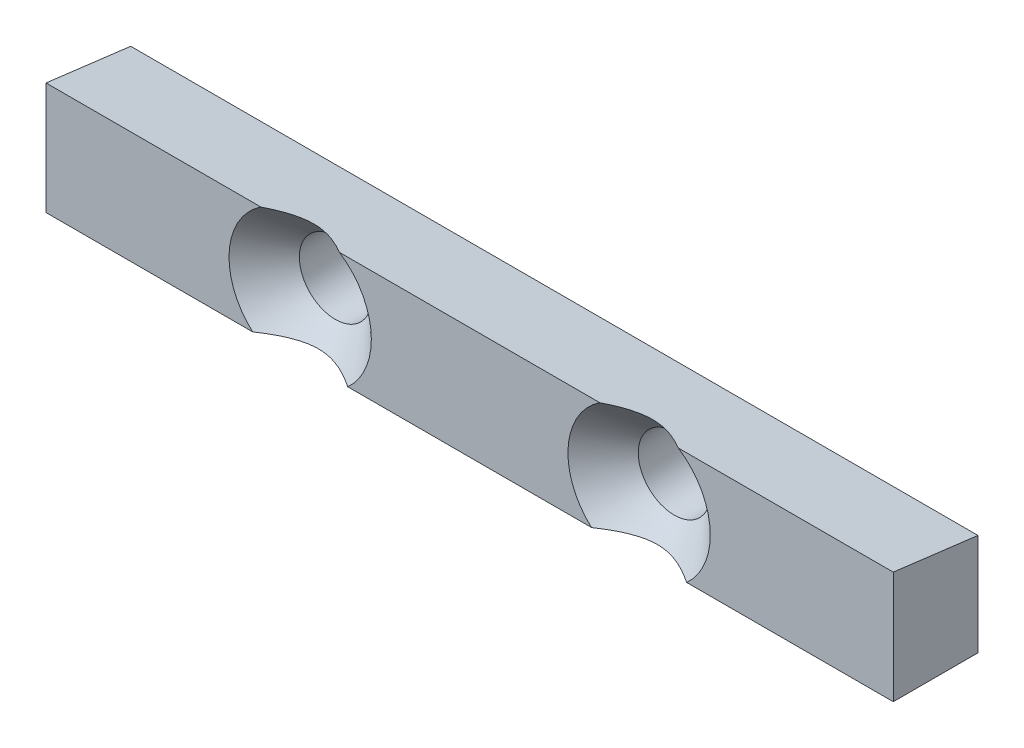
from build123d import *

# Parameters (mm, degrees)
SKETCH_1_W                   = 40
SKETCH_1_H                   = 5.3
EXTRUDE_1_DEPTH              = 4
CUT_EXTRUDE_1_DEPTH          = 41.547379693
SKETCH_3_R                   = 1.5
CUT_EXTRUDE_2_DEPTH          = 41.547379693
HOLE_WIZARD_M3_1_D           = 3.4
HOLE_WIZARD_M3_1_CSINK_D     = 6.72
HOLE_WIZARD_M3_1_CSINK_ANGLE = 90


with BuildPart() as part:
    # 草图1 → 凸台-拉伸1 (new body)
    with BuildSketch(Plane.XY):
        with Locations((20, 2.65)):
            Rectangle(SKETCH_1_W, SKETCH_1_H)
    extrude(amount=EXTRUDE_1_DEPTH)

    # 草图2 → 切除-拉伸1 (cut, through all)
    with BuildSketch(Plane(origin=(40, 0, 0), x_dir=(0, 0, -1), z_dir=(1, 0, 0))):
        Polygon((-4, 5.3), (0, 5.3), (0, 4.8), align=None)
    extrude(amount=-CUT_EXTRUDE_1_DEPTH, mode=Mode.SUBTRACT)

    # 草图3 → 切除-拉伸2 (cut, through all)
    with BuildSketch(Plane.XY.offset(4)):
        with Locations((12, 2.5)):
            Circle(SKETCH_3_R)
        with Locations(Location((28, 2.5, 0), (0, 0, 180))):
            Circle(SKETCH_3_R)
    extrude(amount=-CUT_EXTRUDE_2_DEPTH, mode=Mode.SUBTRACT)

    # M3 六角凹锥坑螺钉的锥形沉头孔1 (through all)
    with Locations(Plane(origin=(12, 2.5, 4), x_dir=(1, 0, 0), z_dir=(0, 0, 1))):
        with Locations((0, 0), (16, 0)):
            CounterSinkHole(HOLE_WIZARD_M3_1_D / 2, HOLE_WIZARD_M3_1_CSINK_D / 2, counter_sink_angle=HOLE_WIZARD_M3_1_CSINK_ANGLE)


solid = part.part
